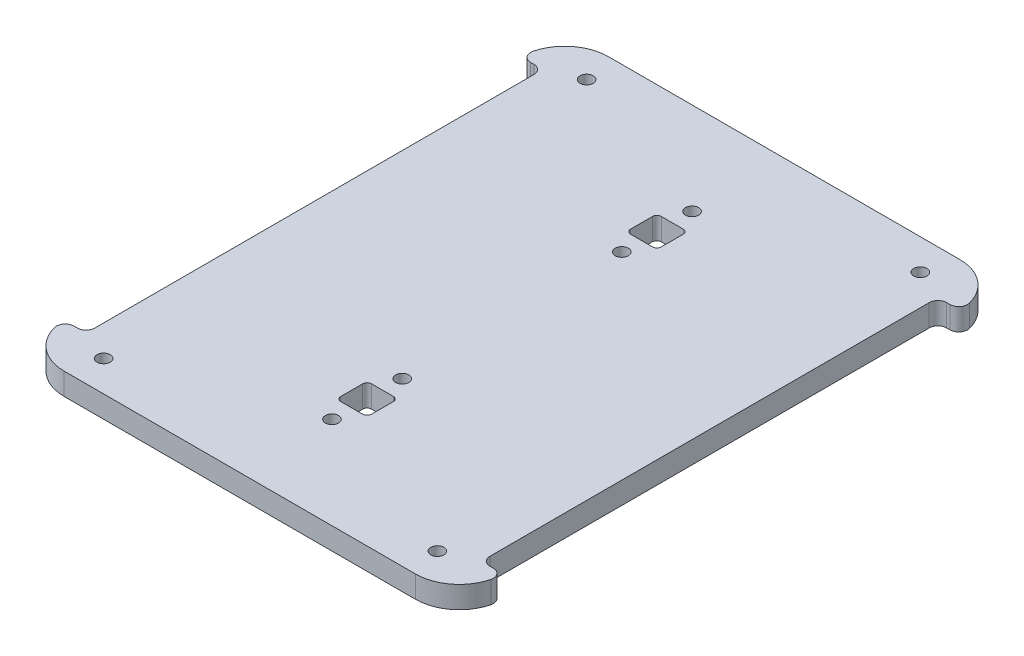
from build123d import *

# Parameters (mm, degrees)
RESSALTO_EXTRUS_O1_DEPTH = 5
ESBO_O2_R                = 1.5
CORTE_EXTRUS_O1_DEPTH    = 5
ESBO_O3_R                = 1.5
CORTE_EXTRUS_O2_DEPTH    = 10


with BuildPart() as part:
    # Esboço1 → Ressalto-extrusão1 (new body)
    with BuildSketch(Plane(origin=(0, 0, 0), x_dir=(1, 0, 0), z_dir=(0, 1, 0))):
        with BuildLine():
            Line((57.825671094, 13.599370915), (57.079704402, 13.599370915))
            ThreePointArc((57.079704402, 13.599370915), (55.665490839, 14.185157352), (55.079704402, 15.599370915))
            Line((55.079704402, 15.599370915), (55.079704402, 115.599370915))
            ThreePointArc((55.079704402, 115.599370915), (55.665490839, 117.013584477), (57.079704402, 117.599370915))
            Line((57.079704402, 117.599370915), (57.825671094, 117.599370915))
            ThreePointArc((57.825671094, 117.599370915), (59.406809924, 118.374626043), (59.762162767, 120.099370915))
            ThreePointArc((59.762162767, 120.099370915), (56.203428759, 125.505065065), (50.079704402, 127.599370915))
            Line((50.079704402, 127.599370915), (-29.920295598, 127.599370915))
            ThreePointArc((-29.920295598, 127.599370915), (-36.044019955, 125.505065065), (-39.602753964, 120.099370915))
            ThreePointArc((-39.602753964, 120.099370915), (-39.247401121, 118.374626043), (-37.666262291, 117.599370915))
            Line((-37.666262291, 117.599370915), (-36.920295598, 117.599370915))
            ThreePointArc((-36.920295598, 117.599370915), (-35.506082036, 117.013584477), (-34.920295598, 115.599370915))
            Line((-34.920295598, 115.599370915), (-34.920295598, 15.599370915))
            ThreePointArc((-34.920295598, 15.599370915), (-35.506082036, 14.185157352), (-36.920295598, 13.599370915))
            Line((-36.920295598, 13.599370915), (-37.666262291, 13.599370915))
            ThreePointArc((-37.666262291, 13.599370915), (-39.247401121, 12.824115786), (-39.602753964, 11.099370915))
            ThreePointArc((-39.602753964, 11.099370915), (-36.044019955, 5.693676764), (-29.920295598, 3.599370915))
            Line((-29.920295598, 3.599370915), (50.079704402, 3.599370915))
            ThreePointArc((50.079704402, 3.599370915), (56.203428759, 5.693676764), (59.762162767, 11.099370915))
            ThreePointArc((59.762162767, 11.099370915), (59.406809924, 12.824115786), (57.825671094, 13.599370915))
        make_face()
    extrude(amount=RESSALTO_EXTRUS_O1_DEPTH)

    # Esboço2 → Corte-extrusão1 (cut)
    with BuildSketch(Plane(origin=(0, 5, 0), x_dir=(1, 0, 0), z_dir=(0, 1, 0))):
        with Locations(Location((10.079704402, 24.599370915, 0), (0, 0, 270))):
            Circle(ESBO_O2_R)
        with Locations(Location((10.079704402, 40.599370915, 0), (0, 0, 270))):
            Circle(ESBO_O2_R)
        with Locations(Location((10.079704402, 90.599370915, 0), (0, 0, 90))):
            Circle(ESBO_O2_R)
        with Locations(Location((10.079704402, 106.599370915, 0), (0, 0, 90))):
            Circle(ESBO_O2_R)
        with BuildLine():
            Line((13.579704402, 96.099370915), (13.579704402, 101.099370915))
            ThreePointArc((13.579704402, 101.099370915), (13.286811183, 101.806477696), (12.579704402, 102.099370915))
            Line((12.579704402, 102.099370915), (7.579704402, 102.099370915))
            ThreePointArc((7.579704402, 102.099370915), (6.872597621, 101.806477696), (6.579704402, 101.099370915))
            Line((6.579704402, 101.099370915), (6.579704402, 96.099370915))
            ThreePointArc((6.579704402, 96.099370915), (6.872597621, 95.392264133), (7.579704402, 95.099370915))
            Line((7.579704402, 95.099370915), (12.579704402, 95.099370915))
            ThreePointArc((12.579704402, 95.099370915), (13.286811183, 95.392264133), (13.579704402, 96.099370915))
        make_face()
        with BuildLine():
            Line((7.579704402, 36.099370915), (12.579704402, 36.099370915))
            ThreePointArc((12.579704402, 36.099370915), (13.286811183, 35.806477696), (13.579704402, 35.099370915))
            Line((13.579704402, 35.099370915), (13.579704402, 30.099370915))
            ThreePointArc((13.579704402, 30.099370915), (13.286811183, 29.392264133), (12.579704402, 29.099370915))
            Line((12.579704402, 29.099370915), (7.579704402, 29.099370915))
            ThreePointArc((7.579704402, 29.099370915), (6.872597621, 29.392264133), (6.579704402, 30.099370915))
            Line((6.579704402, 30.099370915), (6.579704402, 35.099370915))
            ThreePointArc((6.579704402, 35.099370915), (6.872597621, 35.806477696), (7.579704402, 36.099370915))
        make_face()
    extrude(amount=-CORTE_EXTRUS_O1_DEPTH, mode=Mode.SUBTRACT)

    # Esboço3 → Corte-extrusão2 (cut)
    with BuildSketch(Plane(origin=(0, 5, 0), x_dir=(1, 0, 0), z_dir=(0, 1, 0))):
        with Locations(Location((-27.920295598, 10.599370915, 0), (0, 0, 270))):
            Circle(ESBO_O3_R)
        with Locations(Location((48.079704402, 10.599370915, 0), (0, 0, 270))):
            Circle(ESBO_O3_R)
        with Locations(Location((-27.920295598, 120.599370915, 0), (0, 0, 270))):
            Circle(ESBO_O3_R)
        with Locations(Location((48.079704402, 120.599370915, 0), (0, 0, 270))):
            Circle(ESBO_O3_R)
    extrude(amount=-CORTE_EXTRUS_O2_DEPTH, mode=Mode.SUBTRACT)


solid = part.part
